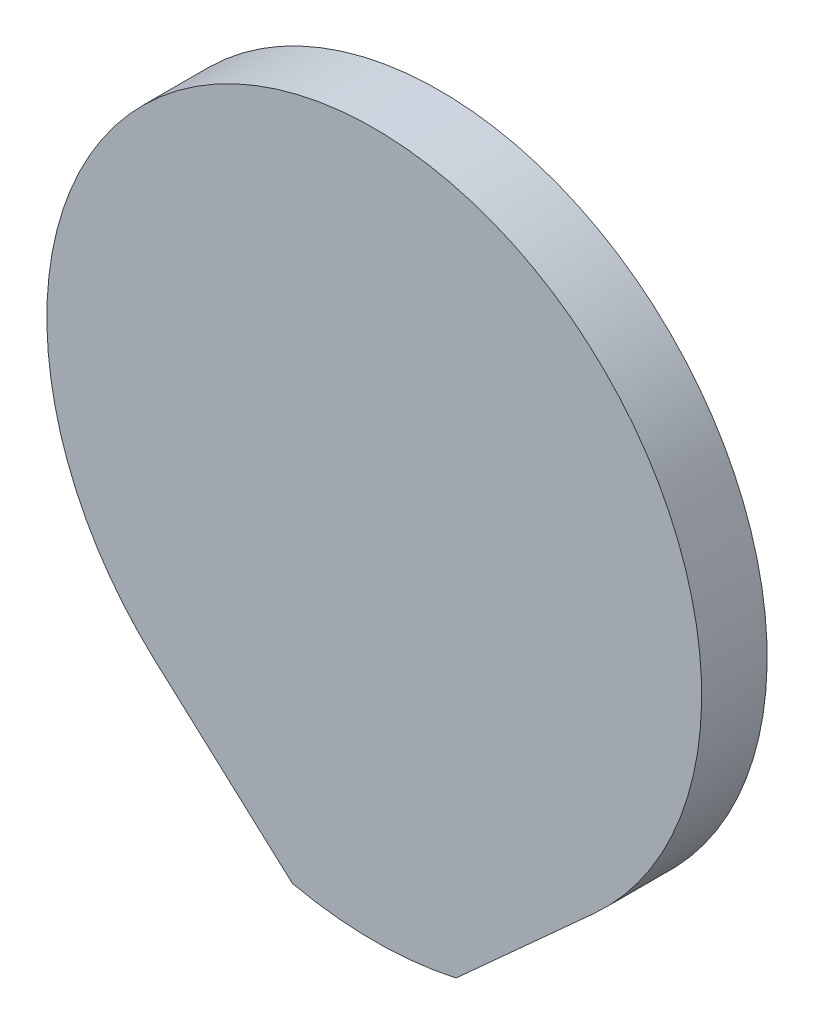
from build123d import *

# Parameters (mm, degrees)
EXTRUDE_1_DEPTH = 40


with BuildPart() as part:
    # 草圖1 → 填料-伸長1 (new body)
    with BuildSketch(Plane.XY):
        with BuildLine():
            Line((50, -224.499443206), (134.208828858, -148.283479378))
            ThreePointArc((134.208828858, -148.283479378), (0, 200), (-134.208828858, -148.283479378))
            Line((-134.208828858, -148.283479378), (-50, -224.499443206))
            ThreePointArc((-50, -224.499443206), (0, -230), (50, -224.499443206))
        make_face()
    extrude(amount=EXTRUDE_1_DEPTH)


solid = part.part
